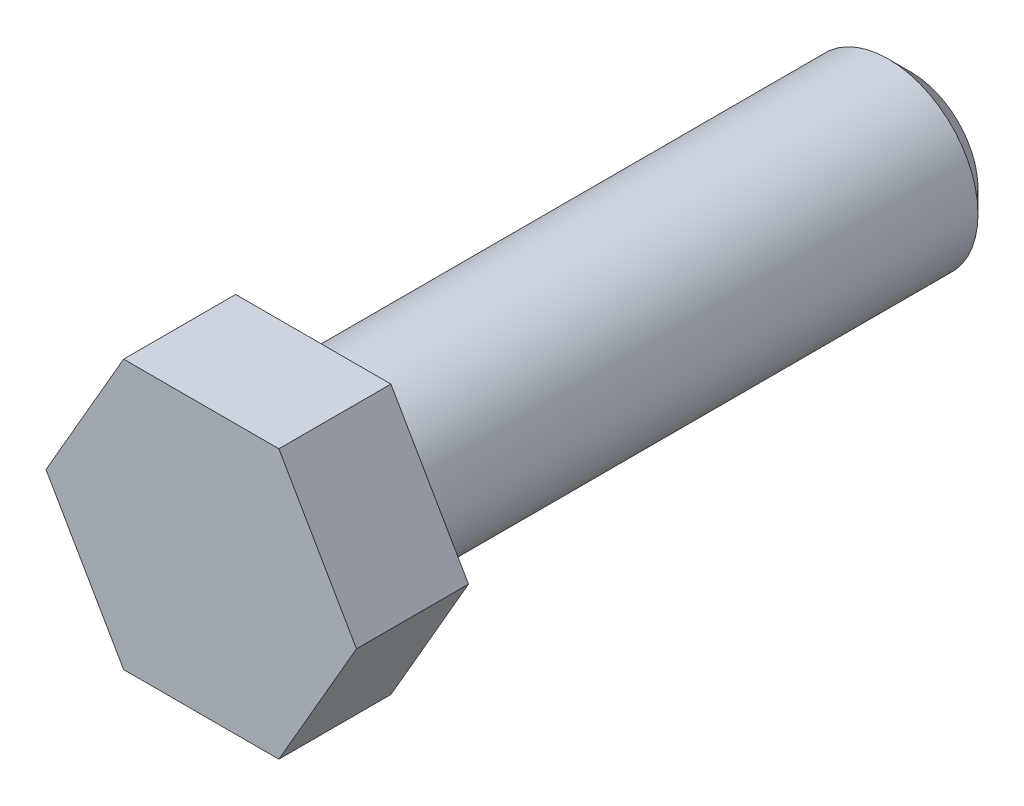
from build123d import *

# Parameters (mm, degrees)
BASE_EXTRUDE_DEPTH  = 7.5
SKETCH3_R           = 6
BOSS_EXTRUDE1_DEPTH = 40
CHAMFER1_SIZE       = 1.5


with BuildPart() as part:
    # Sketch1 → Base-Extrude (new body)
    with BuildSketch(Plane.XY):
        Polygon((-5.196152423, 9), (5.196152423, 9), (10.392304845, 0), (5.196152423, -9), (-5.196152423, -9), (-10.392304845, 0), align=None)
    extrude(amount=BASE_EXTRUDE_DEPTH)

    # Sketch3 → Boss-Extrude1 (add)
    with BuildSketch(Plane(origin=(0, 0, 0), x_dir=(-1, 0, 0), z_dir=(0, 0, -1))):
        with Locations(Location((0, 0, 0), (0, 0, 180))):
            Circle(SKETCH3_R)
    extrude(amount=BOSS_EXTRUDE1_DEPTH)

    # Chamfer1
    chamfer1_edges = [part.edges().sort_by_distance(p)[0] for p in [
        (-6, 0, -40),
    ]]
    chamfer(chamfer1_edges, length=CHAMFER1_SIZE)


solid = part.part
